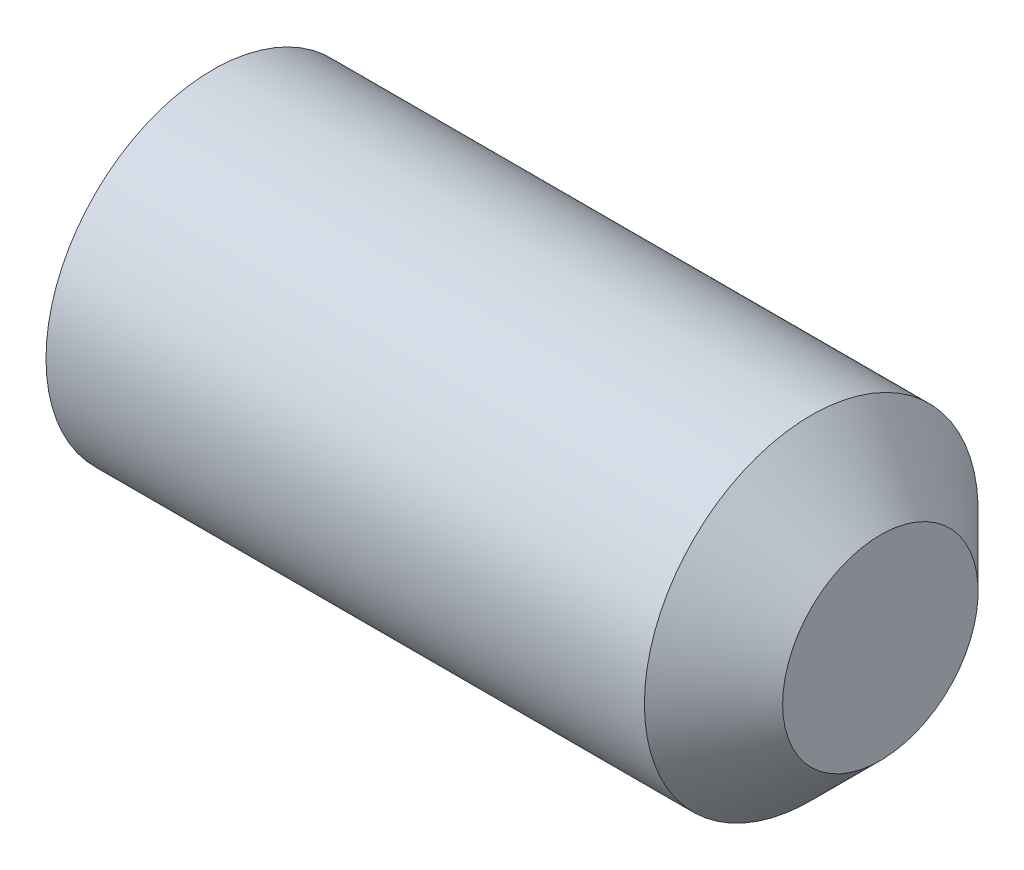
from build123d import *

# Parameters (mm, degrees)
CUT_EXTRUDE1_DEPTH = 2


with BuildPart() as part:
    # Sketch1 → Revolve1 (revolve)
    with BuildSketch(Plane.XY, mode=Mode.PRIVATE) as revolve1_sk:
        Polygon((10, 1.464466094), (10, 0), (0, 0), (0, 2.5), (8.964466094, 2.5), align=None)
    revolve(revolve1_sk.sketch.rotate(Axis((0, 0, 0), (1, 0, 0)), 90), axis=Axis((0, 0, 0), (1, 0, 0)))

    # Sketch2 → Cut-Extrude1 (cut)
    with BuildSketch(Plane.ZY):
        Polygon((-0.721687836, 1.25), (-1.443375673, 0), (-0.721687836, -1.25), (0.721687836, -1.25), (1.443375673, 0), (0.721687836, 1.25), align=None)
    extrude(amount=-CUT_EXTRUDE1_DEPTH, mode=Mode.SUBTRACT)


solid = part.part
